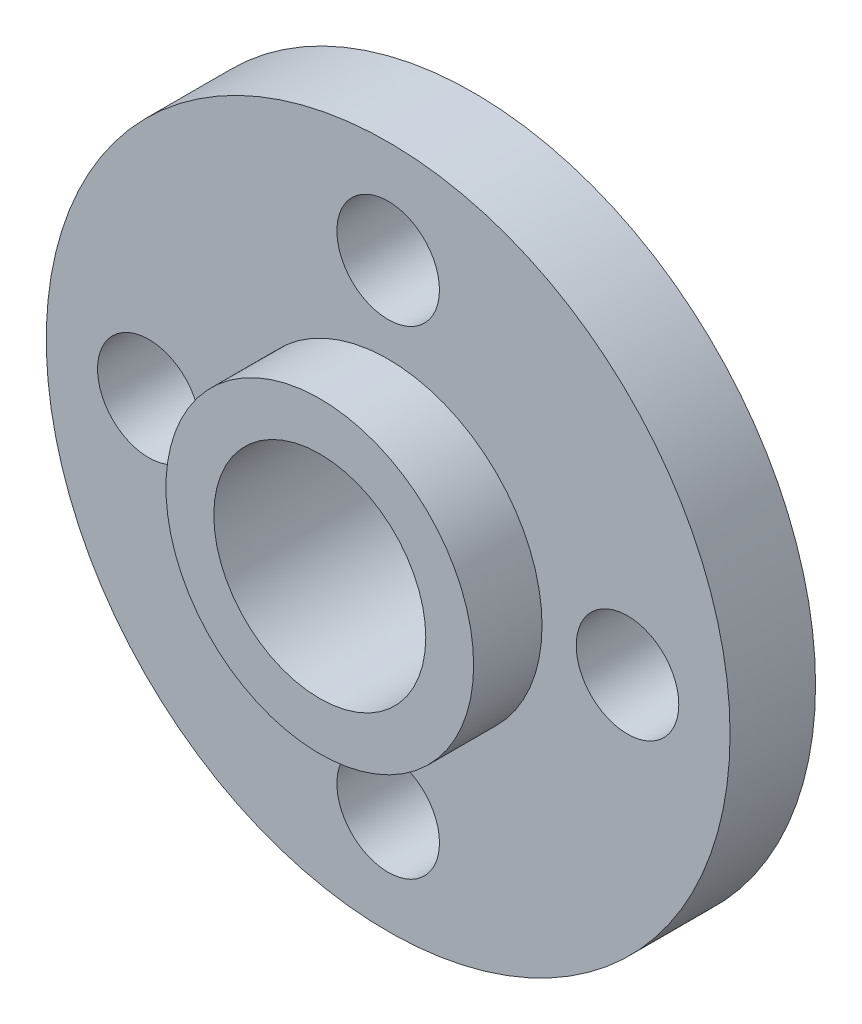
from build123d import *

# Parameters (mm, degrees)
SKETCH_1_R      = 10
SKETCH_1_R_2    = 1.5
SKETCH_1_R_3    = 3.1
EXTRUDE_1_DEPTH = 2.5
SKETCH_2_R      = 4.5
SKETCH_2_R_2    = 3.1
EXTRUDE_2_DEPTH = 2


with BuildPart() as part:
    # 草图1 → 凸台-拉伸1 (new body)
    with BuildSketch(Plane.XY):
        Circle(SKETCH_1_R)
        with Locations((0, 7)):
            Circle(SKETCH_1_R_2, mode=Mode.SUBTRACT)
        with Locations((7, 0)):
            Circle(SKETCH_1_R_2, mode=Mode.SUBTRACT)
        with Locations((0, -7)):
            Circle(SKETCH_1_R_2, mode=Mode.SUBTRACT)
        with Locations((-7, 0)):
            Circle(SKETCH_1_R_2, mode=Mode.SUBTRACT)
        Circle(SKETCH_1_R_3, mode=Mode.SUBTRACT)
    extrude(amount=EXTRUDE_1_DEPTH)

    # 草图2 → 凸台-拉伸2 (add)
    with BuildSketch(Plane.XY.offset(2.5)):
        Circle(SKETCH_2_R)
        Circle(SKETCH_2_R_2, mode=Mode.SUBTRACT)
    extrude(amount=EXTRUDE_2_DEPTH)


solid = part.part
